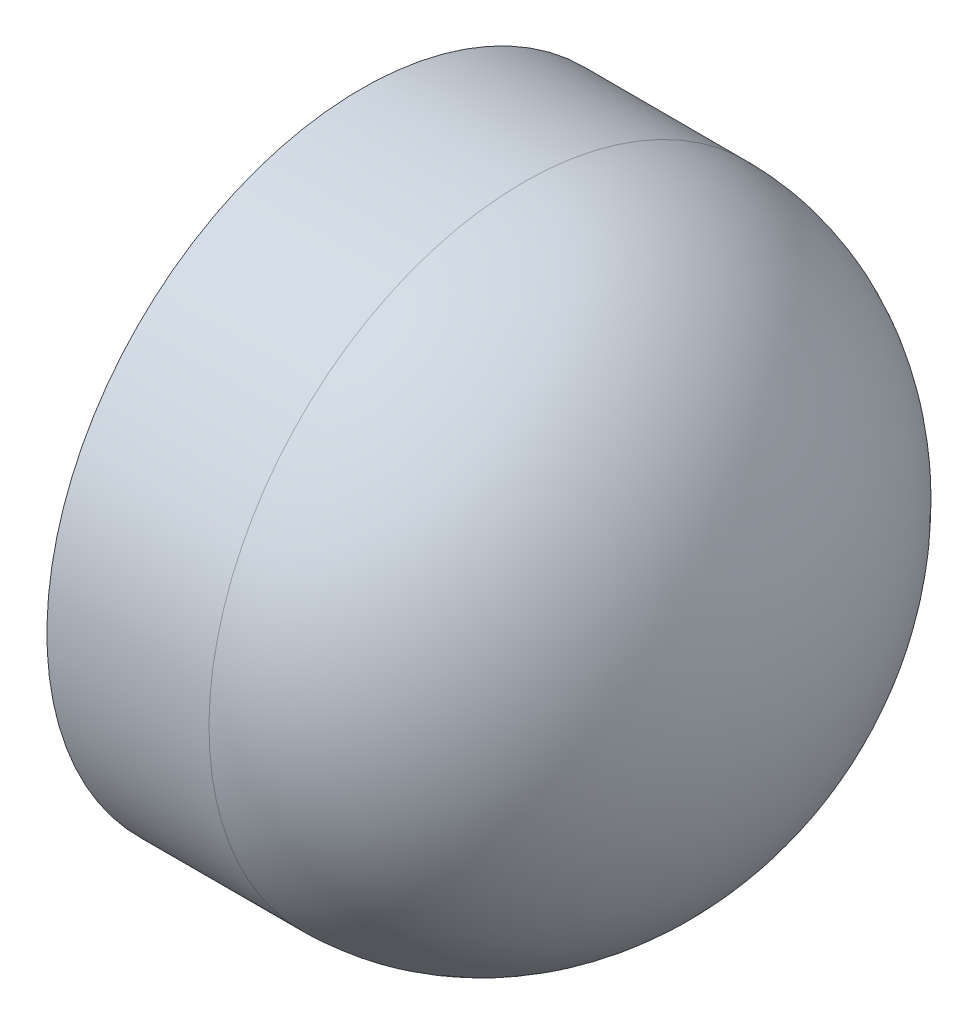
from build123d import *

# Parameters (mm, degrees)
SKETCH1_R               = 4.85
BOSS_EXTRUDE1_DEPTH     = 2.5
DOME1_FACE_RADIUS       = 4.85
DOME1_HEIGHT            = 4
SHELL1_T                = -0.6
CUT_EXTRUDE2_DEPTH      = 4
CUT_EXTRUDE2_DEPTH_BACK = 4
SKETCH4_R               = 1.5


with BuildPart() as part:
    # Sketch1 → Boss-Extrude1 (new body)
    with BuildSketch(Plane(origin=(0, 0, 0), x_dir=(0, 0, -1), z_dir=(1, 0, 0))):
        with Locations((-8.491927182, 4.785070814)):
            Circle(SKETCH1_R)
    extrude(amount=BOSS_EXTRUDE1_DEPTH)

    # Dome1: an elliptical dome of height H over a round flat face of radius A is half a spheroid: the quarter ellipse of half axes A and H revolved about the face's axis
    with BuildSketch(Plane((2.5, 4.785070814, 8.491927182), x_dir=(0, 0, 1), z_dir=(0, 1, 0)), mode=Mode.PRIVATE) as dome1_quarter:
        Ellipse(DOME1_FACE_RADIUS, DOME1_HEIGHT)
        Rectangle(DOME1_FACE_RADIUS, DOME1_HEIGHT, align=(Align.MIN, Align.MIN), mode=Mode.INTERSECT)
    revolve(dome1_quarter.sketch, axis=Axis((2.5, 4.785070814, 8.491927182), (1, 0, 0)))

    # Shell1
    shell1_openings = [part.faces().sort_by_distance(p)[0] for p in [
        (0, 4.785070814, 8.491927182),
    ]]
    offset(amount=SHELL1_T, openings=shell1_openings, kind=Kind.INTERSECTION)

    # Sketch4 → Cut-Extrude2 (cut, two sides: drawn at the far end of the back side and taken through both)
    with BuildSketch(Plane(origin=(0, 0, 0), x_dir=(1, 0, 0), z_dir=(0, 1, 0)).offset(-CUT_EXTRUDE2_DEPTH_BACK)):
        with Locations((0, -8.491927182)):
            Circle(SKETCH4_R)
    extrude(amount=CUT_EXTRUDE2_DEPTH + CUT_EXTRUDE2_DEPTH_BACK, mode=Mode.SUBTRACT)


solid = part.part
